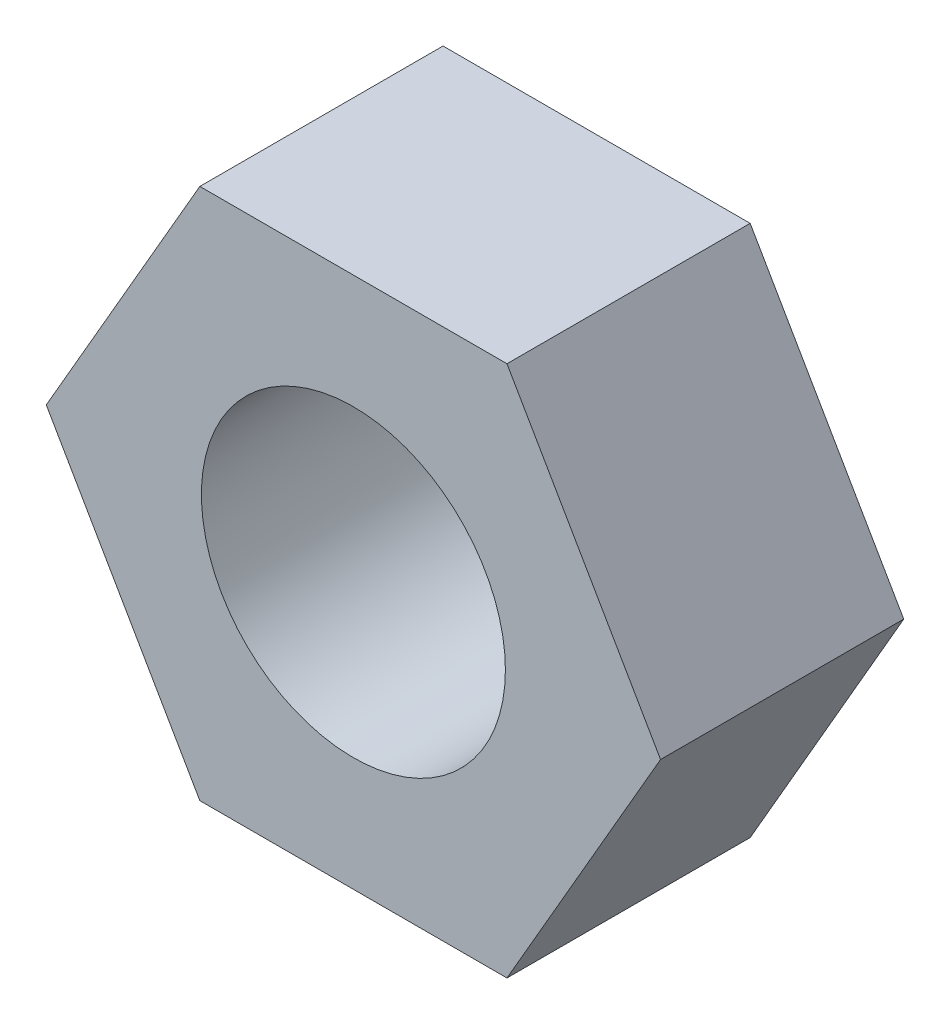
from build123d import *

# Parameters (mm, degrees)
SKETCH_1_R        = 2
EXTRUDE_210_DEPTH = 3.2


with BuildPart() as part:
    # 草图1 → Extrude 210 (new body)
    with BuildSketch(Plane.XY):
        Polygon((4.041451884, 0), (2.020725942, 3.5), (-2.020725942, 3.5), (-4.041451884, 0), (-2.020725942, -3.5), (2.020725942, -3.5), align=None)
        Circle(SKETCH_1_R, mode=Mode.SUBTRACT)
    extrude(amount=EXTRUDE_210_DEPTH)


solid = part.part
